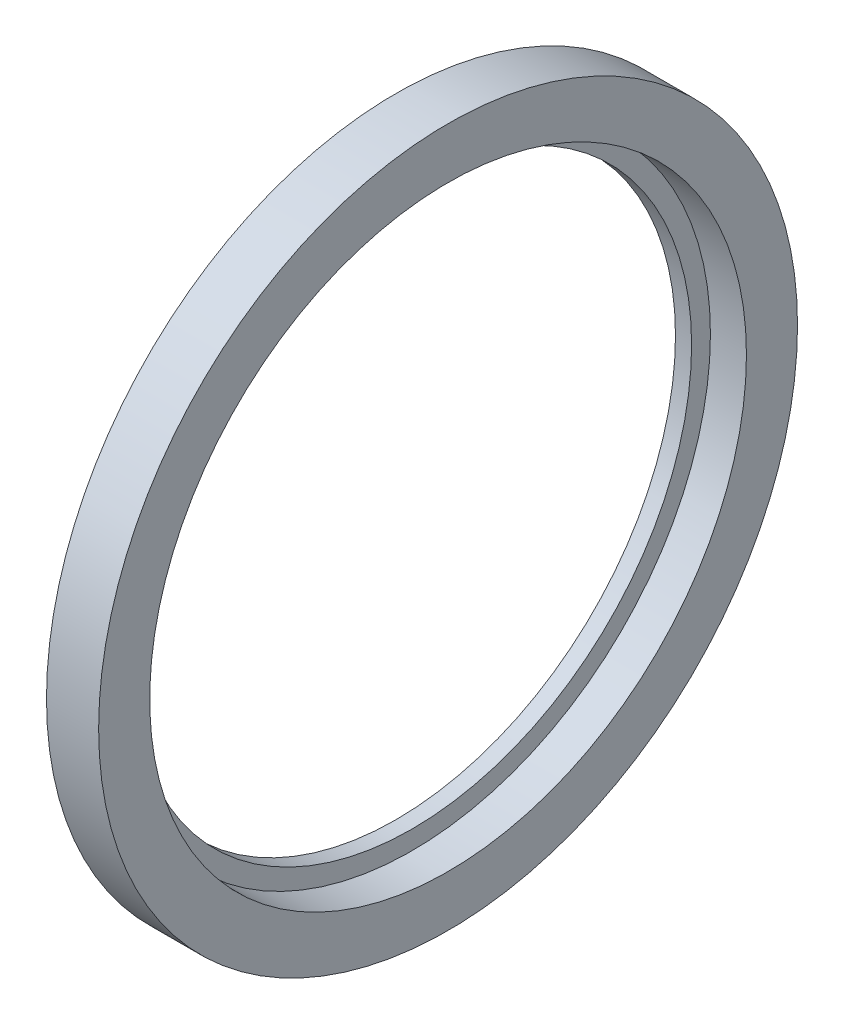
from build123d import *


with BuildPart() as part:
    # Croquis6 → Revolución1 (revolve)
    with BuildSketch(Plane.XY, mode=Mode.PRIVATE) as revoluci_n1_sk:
        Polygon((0, 52), (0, 65), (9.7, 65), (9.7, 55.5), (3, 55.5), (3, 52), align=None)
    revolve(revoluci_n1_sk.sketch.rotate(Axis((12.285, 0, 0), (-1, 0, 0)), 90), axis=Axis((12.285, 0, 0), (-1, 0, 0)))


solid = part.part
